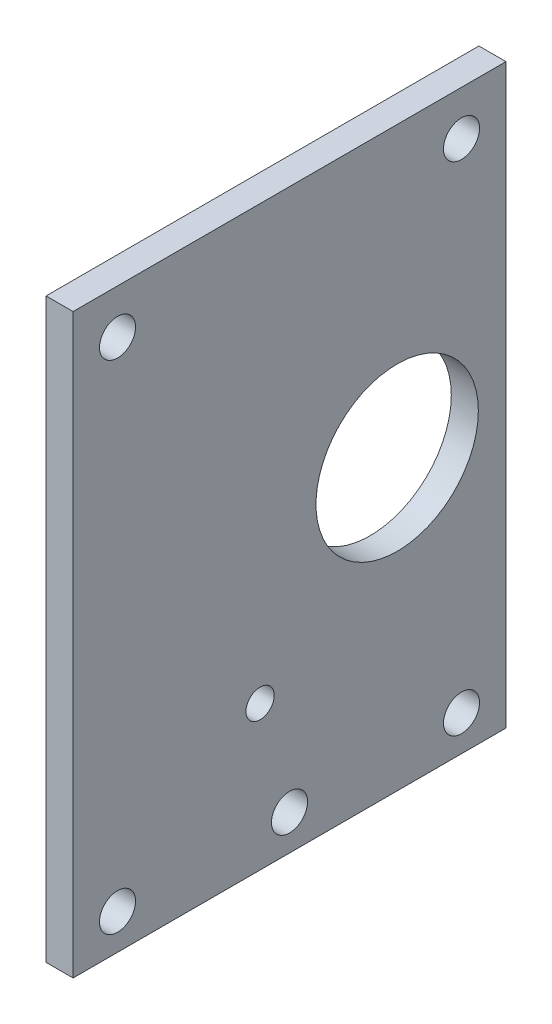
from build123d import *

# Parameters (mm, degrees)
SKETCH2_W           = 76.2
SKETCH2_H           = 101.6
BOSS_EXTRUDE1_DEPTH = 4.7625
SKETCH3_R           = 3.175
CUT_EXTRUDE1_DEPTH  = 6.35
SKETCH3_4_R         = 3.175
SKETCH3_4_R_2       = 14.2875
SKETCH3_4_R_3       = 2.4892
CUT_EXTRUDE2_DEPTH  = 6.35


with BuildPart() as part:
    # Sketch2 → Boss-Extrude1 (new body)
    with BuildSketch(Plane(origin=(0, 0, 0), x_dir=(0, 0, -1), z_dir=(1, 0, 0))):
        Rectangle(SKETCH2_W, SKETCH2_H)
    extrude(amount=BOSS_EXTRUDE1_DEPTH)

    # Sketch3 → Cut-Extrude1 (cut)
    with BuildSketch(Plane(origin=(4.7625, 0, 0), x_dir=(0, 0, -1), z_dir=(1, 0, 0))):
        with Locations((30.2768, 42.9768)):
            Circle(SKETCH3_R)
    extrude(amount=-CUT_EXTRUDE1_DEPTH, mode=Mode.SUBTRACT)

    # Sketch3<4> → Cut-Extrude2 (cut)
    with BuildSketch(Plane(origin=(4.7625, 0, 0), x_dir=(0, 0, -1), z_dir=(1, 0, 0))):
        with Locations((30.2768, -44.5643)):
            Circle(SKETCH3_4_R)
        with Locations((30.2768, 42.9768)):
            Circle(SKETCH3_4_R)
        with Locations((-30.2768, 42.9768)):
            Circle(SKETCH3_4_R)
        with Locations((-30.2768, -44.5643)):
            Circle(SKETCH3_4_R)
        with Locations((18.9484, 0)):
            Circle(SKETCH3_4_R_2)
        with Locations((-5.1816, -25.4)):
            Circle(SKETCH3_4_R_3)
        with Locations((0, -44.5643)):
            Circle(SKETCH3_4_R)
    extrude(amount=-CUT_EXTRUDE2_DEPTH, mode=Mode.SUBTRACT)


solid = part.part
